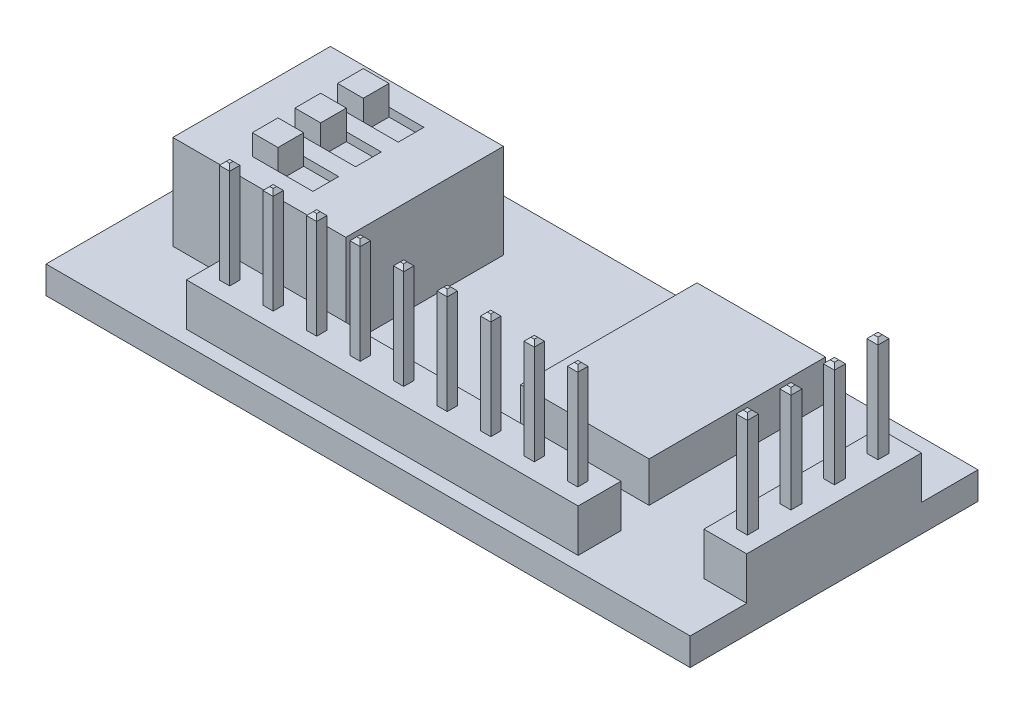
from build123d import *

# Parameters (mm, degrees)
SKETCH1_W              = 37.6
SKETCH1_H              = 16.8
BOSS_EXTRUDE1_DEPTH    = 1.6
SKETCH3_W              = 22.86
SKETCH3_H              = 2.5
BOSS_EXTRUDE3_DEPTH    = 2.5
SKETCH2_W              = 0.6
SKETCH2_H              = 0.6
BOSS_EXTRUDE2_DEPTH    = 8.5
SKETCH4_W              = 2.5
SKETCH4_H              = 10.2
BOSS_EXTRUDE4_DEPTH    = 2.5
SKETCH9_W              = 7.5
SKETCH9_H              = 10.3
BOSS_EXTRUDE9_DEPTH    = 2.35
SKETCH10_W             = 0.65
SKETCH10_H             = 0.65
BOSS_EXTRUDE10_DEPTH   = 6
CHAMFER1_SIZE          = 0.2
SKETCH11_W             = 10.1
SKETCH11_H             = 9.2
BOSS_EXTRUDE11_DEPTH   = 5.5
SKETCH12_W             = 3.54
SKETCH12_H             = 1.5
CUT_EXTRUDE1_DEPTH     = 0.5
SKETCH13_W             = 1.5
SKETCH13_H             = 1.5
BOSS_EXTRUDE12_DEPTH   = 1.7
BOSS_EXTRUDE12_2_DEPTH = 1.7
BOSS_EXTRUDE12_3_DEPTH = 1.7


with BuildPart() as part:
    # Sketch1 → Boss-Extrude1 (new body)
    with BuildSketch(Plane(origin=(0, 0, 0), x_dir=(1, 0, 0), z_dir=(0, 1, 0))):
        Rectangle(SKETCH1_W, SKETCH1_H)
    extrude(amount=BOSS_EXTRUDE1_DEPTH)

    # Sketch3 → Boss-Extrude3 (add)
    with BuildSketch(Plane(origin=(0, 1.6, 0), x_dir=(1, 0, 0), z_dir=(0, 1, 0))):
        with Locations((0.03, -6.35)):
            Rectangle(SKETCH3_W, SKETCH3_H)
    extrude(amount=BOSS_EXTRUDE3_DEPTH)

    # Sketch2 → Boss-Extrude2 (add)
    with BuildSketch(Plane(origin=(0, 1.6, 0), x_dir=(1, 0, 0), z_dir=(0, 1, 0))):
        with Locations((-7.59, -6.35)):
            Rectangle(SKETCH2_W, SKETCH2_H)
        with Locations((-10.13, -6.35)):
            Rectangle(SKETCH2_W, SKETCH2_H)
        with Locations((-5.05, -6.35)):
            Rectangle(SKETCH2_W, SKETCH2_H)
        with Locations((-2.51, -6.35)):
            Rectangle(SKETCH2_W, SKETCH2_H)
        with Locations((0.03, -6.35)):
            Rectangle(SKETCH2_W, SKETCH2_H)
        with Locations((2.57, -6.35)):
            Rectangle(SKETCH2_W, SKETCH2_H)
        with Locations((5.11, -6.35)):
            Rectangle(SKETCH2_W, SKETCH2_H)
        with Locations((7.65, -6.35)):
            Rectangle(SKETCH2_W, SKETCH2_H)
        with Locations((10.19, -6.35)):
            Rectangle(SKETCH2_W, SKETCH2_H)
    extrude(amount=BOSS_EXTRUDE2_DEPTH)

    # Sketch9 → Boss-Extrude9 (add)
    with BuildSketch(Plane(origin=(0, 1.6, 0), x_dir=(1, 0, 0), z_dir=(0, 1, 0))):
        with Locations((7.25, 2.15)):
            Rectangle(SKETCH9_W, SKETCH9_H)
    extrude(amount=BOSS_EXTRUDE9_DEPTH)


with BuildPart() as body_2:
    # Sketch4 → Boss-Extrude4 (new body)
    with BuildSketch(Plane(origin=(0, 1.6, 0), x_dir=(1, 0, 0), z_dir=(0, 1, 0))):
        with Locations((17.55, 0)):
            Rectangle(SKETCH4_W, SKETCH4_H)
    extrude(amount=BOSS_EXTRUDE4_DEPTH)


    add(part.part)  # Boss-Extrude10 merges part
    # Sketch10 → Boss-Extrude10 (add)
    with BuildSketch(Plane(origin=(0, 4.1, 0), x_dir=(1, 0, 0), z_dir=(0, 1, 0))):
        with Locations((17.55, -1.27)):
            Rectangle(SKETCH10_W, SKETCH10_H)
        with Locations((17.55, 1.27)):
            Rectangle(SKETCH10_W, SKETCH10_H)
        with Locations((17.55, 3.81)):
            Rectangle(SKETCH10_W, SKETCH10_H)
        with Locations((17.55, -3.81)):
            Rectangle(SKETCH10_W, SKETCH10_H)
    extrude(amount=BOSS_EXTRUDE10_DEPTH)

    # Chamfer1
    chamfer1_edges = [body_2.edges().sort_by_distance(p)[0] for p in [
        (17.55, 10.1, -1.595),
        (17.875, 10.1, -1.27),
        (17.55, 10.1, -0.945),
        (17.225, 10.1, -1.27),
        (17.55, 10.1, -4.135),
        (17.875, 10.1, -3.81),
        (17.55, 10.1, -3.485),
        (17.225, 10.1, -3.81),
        (17.55, 10.1, 3.485),
        (17.875, 10.1, 3.81),
        (17.55, 10.1, 4.135),
        (17.225, 10.1, 3.81),
        (17.55, 10.1, 0.945),
        (17.875, 10.1, 1.27),
        (17.55, 10.1, 1.595),
        (17.225, 10.1, 1.27),
        (-10.43, 10.1, 6.35),
        (-10.13, 10.1, 6.65),
        (-9.83, 10.1, 6.35),
        (-10.13, 10.1, 6.05),
        (-7.89, 10.1, 6.35),
        (-7.59, 10.1, 6.65),
        (-7.29, 10.1, 6.35),
        (-7.59, 10.1, 6.05),
        (-5.35, 10.1, 6.35),
        (-5.05, 10.1, 6.65),
        (-4.75, 10.1, 6.35),
        (-5.05, 10.1, 6.05),
        (-2.81, 10.1, 6.35),
        (-2.51, 10.1, 6.65),
        (-2.21, 10.1, 6.35),
        (-2.51, 10.1, 6.05),
        (-0.27, 10.1, 6.35),
        (0.03, 10.1, 6.65),
        (0.33, 10.1, 6.35),
        (0.03, 10.1, 6.05),
        (2.27, 10.1, 6.35),
        (2.57, 10.1, 6.65),
        (2.87, 10.1, 6.35),
        (2.57, 10.1, 6.05),
        (4.81, 10.1, 6.35),
        (5.11, 10.1, 6.65),
        (5.41, 10.1, 6.35),
        (5.11, 10.1, 6.05),
        (7.35, 10.1, 6.35),
        (7.65, 10.1, 6.65),
        (7.95, 10.1, 6.35),
        (7.65, 10.1, 6.05),
        (9.89, 10.1, 6.35),
        (10.19, 10.1, 6.65),
        (10.49, 10.1, 6.35),
        (10.19, 10.1, 6.05),
    ]]
    chamfer(chamfer1_edges, length=CHAMFER1_SIZE)

    # Sketch11 → Boss-Extrude11 (add)
    with BuildSketch(Plane(origin=(0, 1.6, 0), x_dir=(1, 0, 0), z_dir=(0, 1, 0))):
        with Locations((-10.95, 0.8)):
            Rectangle(SKETCH11_W, SKETCH11_H)
    extrude(amount=BOSS_EXTRUDE11_DEPTH)

    # Sketch12 → Cut-Extrude1 (cut)
    with BuildSketch(Plane(origin=(0, 7.1, 0), x_dir=(1, 0, 0), z_dir=(0, 1, 0))):
        with Locations((-10.95, 3.29)):
            Rectangle(SKETCH12_W, SKETCH12_H)
        with Locations((-10.95, 0.8)):
            Rectangle(SKETCH12_W, SKETCH12_H)
        with Locations((-10.95, -1.69)):
            Rectangle(SKETCH12_W, SKETCH12_H)
    extrude(amount=-CUT_EXTRUDE1_DEPTH, mode=Mode.SUBTRACT)


with BuildPart() as body_2_2:
    # Sketch13 → Boss-Extrude12 (new body)
    with BuildSketch(Plane(origin=(0, 6.6, 0), x_dir=(1, 0, 0), z_dir=(0, 1, 0))):
        with Locations((-11.97, 3.29)):
            Rectangle(SKETCH13_W, SKETCH13_H)
    extrude(amount=BOSS_EXTRUDE12_DEPTH)


with BuildPart() as body_3:
    # Sketch13 → Boss-Extrude12 2 (new body)
    with BuildSketch(Plane(origin=(0, 6.6, 0), x_dir=(1, 0, 0), z_dir=(0, 1, 0))):
        with Locations((-11.97, 0.8)):
            Rectangle(SKETCH13_W, SKETCH13_H)
    extrude(amount=BOSS_EXTRUDE12_2_DEPTH)


with BuildPart() as body_4:
    # Sketch13 → Boss-Extrude12 3 (new body)
    with BuildSketch(Plane(origin=(0, 6.6, 0), x_dir=(1, 0, 0), z_dir=(0, 1, 0))):
        with Locations((-11.97, -1.69)):
            Rectangle(SKETCH13_W, SKETCH13_H)
    extrude(amount=BOSS_EXTRUDE12_3_DEPTH)


solid = Compound([body_2.part, body_2_2.part, body_3.part, body_4.part])
